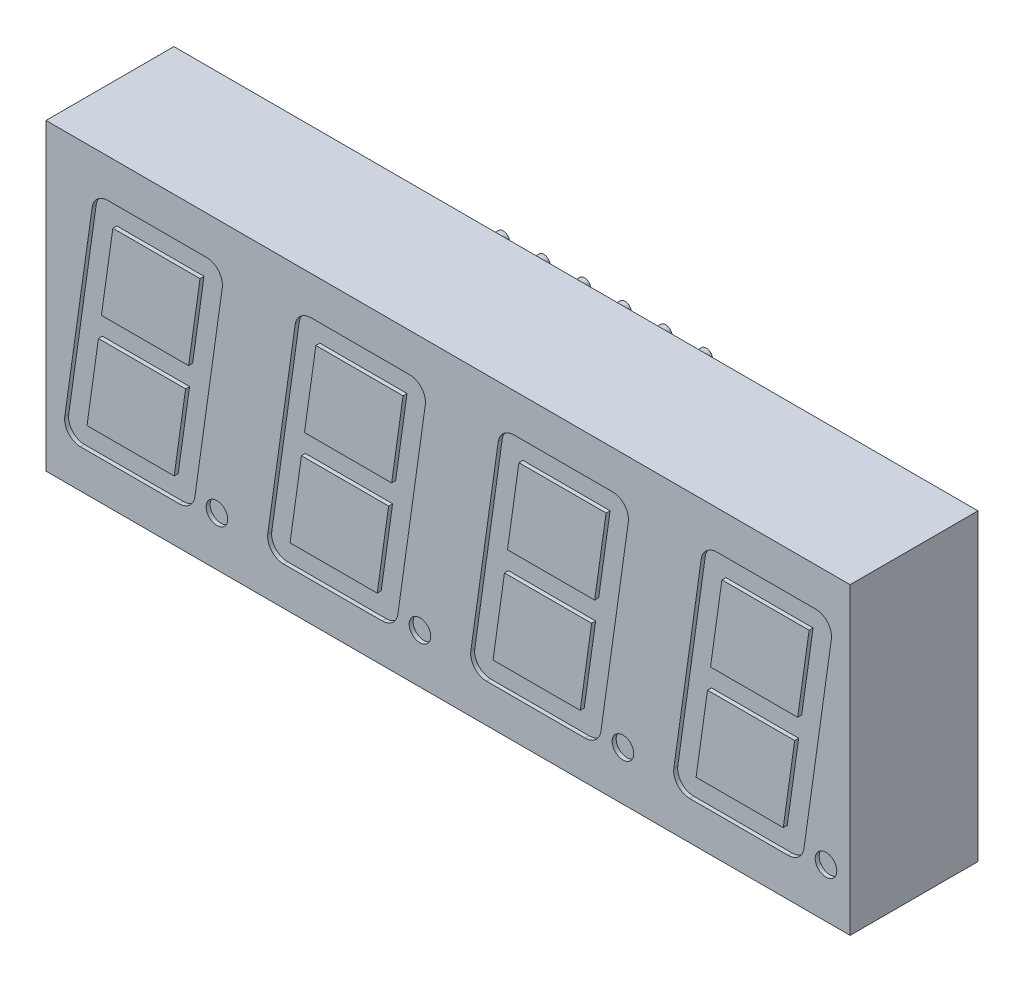
from build123d import *

# Parameters (mm, degrees)
SKETCH_1_W          = 50.3
SKETCH_1_H          = 19
EXTRUDE_1_DEPTH     = 8
SKETCH_2_R          = 0.4
EXTRUDE_2_DEPTH     = 1.8
SKETCH_3_R          = 0.675
CUT_EXTRUDE_1_DEPTH = 0.25


with BuildPart() as part:
    # 草图1 → 凸台-拉伸1 (new body)
    with BuildSketch(Plane.XY):
        with Locations((25.15, 9.5)):
            Rectangle(SKETCH_1_W, SKETCH_1_H)
    extrude(amount=EXTRUDE_1_DEPTH)

    # 草图2 → 凸台-拉伸2 (add)
    with BuildSketch(Plane(origin=(0, 0, 0), x_dir=(-1, 0, 0), z_dir=(0, 0, -1))):
        with Locations((-31.5, 17.12)):
            Circle(SKETCH_2_R)
        with Locations((-28.96, 17.12)):
            Circle(SKETCH_2_R)
        with Locations((-26.42, 17.12)):
            Circle(SKETCH_2_R)
        with Locations((-23.88, 17.12)):
            Circle(SKETCH_2_R)
        with Locations((-21.34, 17.12)):
            Circle(SKETCH_2_R)
        with Locations((-18.8, 17.12)):
            Circle(SKETCH_2_R)
        with Locations(Location((-18.8, 1.88, 0), (0, 0, 180))):
            Circle(SKETCH_2_R)
        with Locations(Location((-21.34, 1.88, 0), (0, 0, 180))):
            Circle(SKETCH_2_R)
        with Locations(Location((-23.88, 1.88, 0), (0, 0, 180))):
            Circle(SKETCH_2_R)
        with Locations(Location((-26.42, 1.88, 0), (0, 0, 180))):
            Circle(SKETCH_2_R)
        with Locations(Location((-28.96, 1.88, 0), (0, 0, 180))):
            Circle(SKETCH_2_R)
        with Locations(Location((-31.5, 1.88, 0), (0, 0, 180))):
            Circle(SKETCH_2_R)
    extrude(amount=EXTRUDE_2_DEPTH)

    # 草图3 → 切除-拉伸1 (cut)
    # profile 1 of 8: a face of its own
    with BuildSketch(Plane.XY.offset(8)):
        with BuildLine():
            ThreePointArc((9.312943073, 3.260826899), (8.978734033, 2.64529042), (8.322675004, 2.4))
            Line((8.322675004, 2.4), (2.162726812, 2.4))
            ThreePointArc((2.162726812, 2.4), (1.408017232, 2.743940971), (1.172458743, 3.539173101))
            Line((1.172458743, 3.539173101), (2.887056927, 15.739173101))
            ThreePointArc((2.887056927, 15.739173101), (3.221265967, 16.35470958), (3.877324996, 16.6))
            Line((3.877324996, 16.6), (10.037273188, 16.6))
            ThreePointArc((10.037273188, 16.6), (10.791982768, 16.256059029), (11.027541257, 15.460826899))
            Line((11.027541257, 15.460826899), (9.312943073, 3.260826899))
        make_face()
        Polygon((3.468330618, 10.175), (8.921399509, 10.175), (9.634644245, 15.25), (4.181575354, 15.25), align=None, mode=Mode.SUBTRACT)
        Polygon((3.278600491, 8.825), (2.565355755, 3.75), (8.018424646, 3.75), (8.731669382, 8.825), align=None, mode=Mode.SUBTRACT)
    # profile 2 of 8: a face of its own
    with BuildSketch(Plane.XY.offset(8)):
        with BuildLine():
            Line((23.727541257, 15.460826899), (22.012943073, 3.260826899))
            ThreePointArc((22.012943073, 3.260826899), (21.678734033, 2.64529042), (21.022675004, 2.4))
            Line((21.022675004, 2.4), (14.862726812, 2.4))
            ThreePointArc((14.862726812, 2.4), (14.108017232, 2.743940971), (13.872458743, 3.539173101))
            Line((13.872458743, 3.539173101), (15.587056927, 15.739173101))
            ThreePointArc((15.587056927, 15.739173101), (15.921265967, 16.35470958), (16.577324996, 16.6))
            Line((16.577324996, 16.6), (22.737273188, 16.6))
            ThreePointArc((22.737273188, 16.6), (23.491982768, 16.256059029), (23.727541257, 15.460826899))
        make_face()
        Polygon((16.168330618, 10.175), (21.621399509, 10.175), (22.334644245, 15.25), (16.881575354, 15.25), align=None, mode=Mode.SUBTRACT)
        Polygon((15.265355755, 3.75), (20.718424646, 3.75), (21.431669382, 8.825), (15.978600491, 8.825), align=None, mode=Mode.SUBTRACT)
    # profile 3 of 8: a face of its own
    with BuildSketch(Plane.XY.offset(8)):
        with BuildLine():
            Line((36.427541257, 15.460826899), (34.712943073, 3.260826899))
            ThreePointArc((34.712943073, 3.260826899), (34.378734033, 2.64529042), (33.722675004, 2.4))
            Line((33.722675004, 2.4), (27.562726812, 2.4))
            ThreePointArc((27.562726812, 2.4), (26.808017232, 2.743940971), (26.572458743, 3.539173101))
            Line((26.572458743, 3.539173101), (28.287056927, 15.739173101))
            ThreePointArc((28.287056927, 15.739173101), (28.621265967, 16.35470958), (29.277324996, 16.6))
            Line((29.277324996, 16.6), (35.437273188, 16.6))
            ThreePointArc((35.437273188, 16.6), (36.191982768, 16.256059029), (36.427541257, 15.460826899))
        make_face()
        Polygon((28.868330618, 10.175), (34.321399509, 10.175), (35.034644245, 15.25), (29.581575354, 15.25), align=None, mode=Mode.SUBTRACT)
        Polygon((27.965355755, 3.75), (33.418424646, 3.75), (34.131669382, 8.825), (28.678600491, 8.825), align=None, mode=Mode.SUBTRACT)
    # profile 4 of 8: a face of its own
    with BuildSketch(Plane.XY.offset(8)):
        with BuildLine():
            Line((49.127541257, 15.460826899), (47.412943073, 3.260826899))
            ThreePointArc((47.412943073, 3.260826899), (47.078734033, 2.64529042), (46.422675004, 2.4))
            Line((46.422675004, 2.4), (40.262726812, 2.4))
            ThreePointArc((40.262726812, 2.4), (39.508017232, 2.743940971), (39.272458743, 3.539173101))
            Line((39.272458743, 3.539173101), (40.987056927, 15.739173101))
            ThreePointArc((40.987056927, 15.739173101), (41.321265967, 16.35470958), (41.977324996, 16.6))
            Line((41.977324996, 16.6), (48.137273188, 16.6))
            ThreePointArc((48.137273188, 16.6), (48.891982768, 16.256059029), (49.127541257, 15.460826899))
        make_face()
        Polygon((41.568330618, 10.175), (47.021399509, 10.175), (47.734644245, 15.25), (42.281575354, 15.25), align=None, mode=Mode.SUBTRACT)
        Polygon((40.665355755, 3.75), (46.118424646, 3.75), (46.831669382, 8.825), (41.378600491, 8.825), align=None, mode=Mode.SUBTRACT)
    # profile 5 of 8: a face of its own
    with BuildSketch(Plane.XY.offset(8)):
        with Locations((10.691961742, 3.075)):
            Circle(SKETCH_3_R)
    # profile 6 of 8: a face of its own
    with BuildSketch(Plane.XY.offset(8)):
        with Locations((23.391961742, 3.075)):
            Circle(SKETCH_3_R)
    # profile 7 of 8: a face of its own
    with BuildSketch(Plane.XY.offset(8)):
        with Locations((36.091961742, 3.075)):
            Circle(SKETCH_3_R)
    # profile 8 of 8: a face of its own
    with BuildSketch(Plane.XY.offset(8)):
        with Locations((48.791961742, 3.075)):
            Circle(SKETCH_3_R)
    extrude(amount=-CUT_EXTRUDE_1_DEPTH, mode=Mode.SUBTRACT)


solid = part.part
